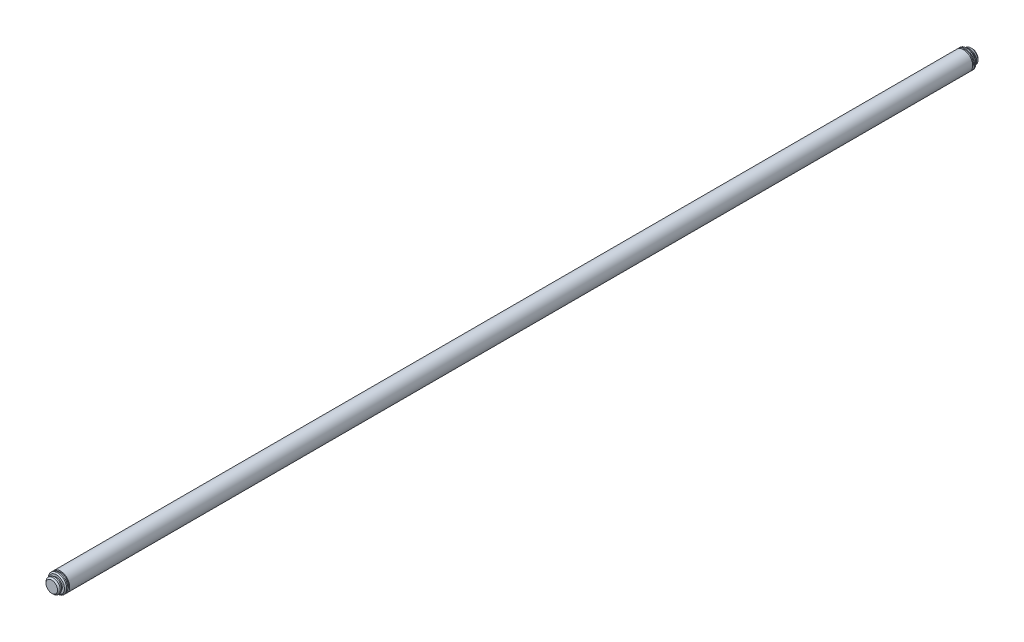
from build123d import *


with BuildPart() as part:
    # Esboço2 → Revolução1 (revolve)
    with BuildSketch(Plane(origin=(0, 0, 0), x_dir=(1, 0, 0), z_dir=(0, 1, 0)), mode=Mode.PRIVATE) as revolu_o1_sk:
        Polygon((-2.5, 0), (0, 0), (0, 400), (-2.5, 400), (-3.1, 399.4), (-3.1, 398.8), (-2.6, 398.8), (-2.6, 398), (-3.5, 398), (-4, 397.5), (-4, 397), (-3.5, 397), (-3.5, 396.2), (-4, 396.2), (-4, 3.8), (-3.5, 3.8), (-3.5, 3), (-4, 3), (-4, 2.5), (-3.5, 2), (-2.6, 2), (-2.6, 1.2), (-3.1, 1.2), (-3.1, 0.6), align=None)
    revolve(revolu_o1_sk.sketch.rotate(Axis((0, 0, 0), (0, 0, -1)), 180), axis=Axis((0, 0, 0), (0, 0, -1)))


solid = part.part
